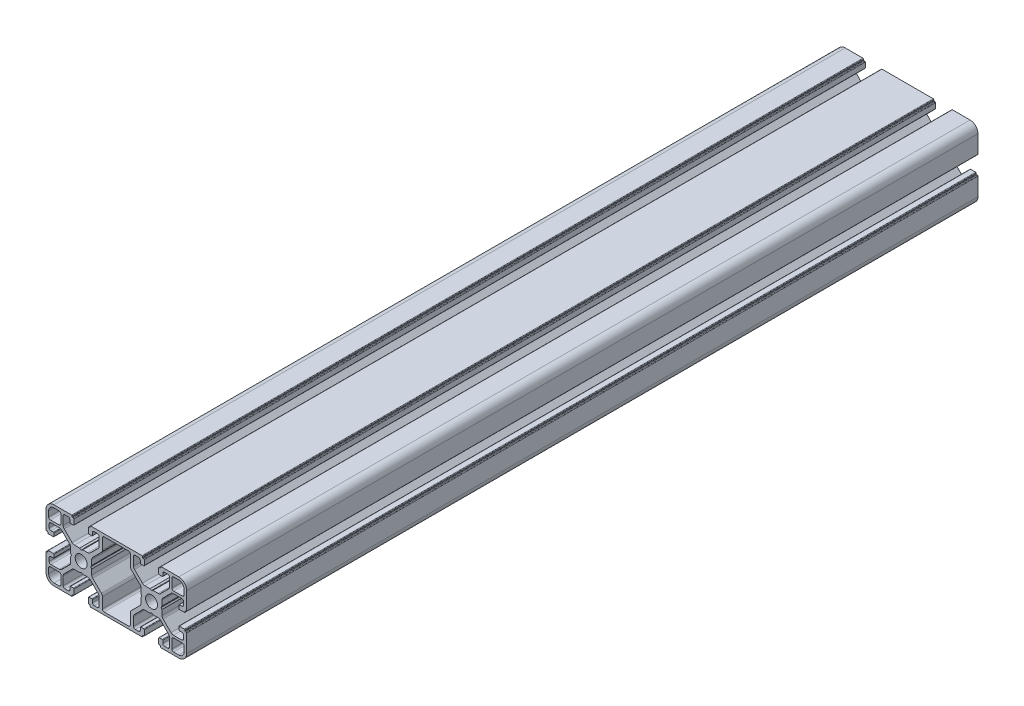
from build123d import *

# Parameters (mm, degrees)
MODEL_R             = 3.4
BOSS_EXTRUDE1_DEPTH = 450


with BuildPart() as part:
    # Model → Boss-Extrude1 (new body)
    with BuildSketch(Plane.XY):
        with BuildLine():
            Line((15.6, -19), (15.1, -19))
            ThreePointArc((15.1, -19), (14.958578644, -19.058578644), (14.9, -19.2))
            Line((14.9, -19.2), (14.9, -19.7))
            ThreePointArc((14.9, -19.7), (14.812132034, -19.912132034), (14.6, -20))
            Line((14.6, -20), (-14.6, -20))
            ThreePointArc((-14.6, -20), (-14.812132034, -19.912132034), (-14.9, -19.7))
            Line((-14.9, -19.7), (-14.9, -19.2))
            ThreePointArc((-14.9, -19.2), (-14.958578644, -19.058578644), (-15.1, -19))
            Line((-15.1, -19), (-15.6, -19))
            ThreePointArc((-15.6, -19), (-15.798740378, -18.973110567), (-15.9, -18.8))
            Line((-15.9, -18.8), (-15.9, -15.8))
            ThreePointArc((-15.9, -15.8), (-15.812132034, -15.587867966), (-15.6, -15.5))
            Line((-15.6, -15.5), (-13.9, -15.5))
            ThreePointArc((-13.9, -15.5), (-13.687867966, -15.587867966), (-13.6, -15.8))
            Line((-13.6, -15.8), (-13.6, -17.2))
            ThreePointArc((-13.6, -17.2), (-13.307106781, -17.907106781), (-12.6, -18.2))
            Line((-12.6, -18.2), (-10.75, -18.2))
            ThreePointArc((-10.75, -18.2), (-10.042893219, -17.907106781), (-9.75, -17.2))
            Line((-9.75, -17.2), (-9.75, -12.492640687))
            ThreePointArc((-9.75, -12.492640687), (-9.902240935, -11.727273822), (-10.335786438, -11.078427125))
            Line((-10.335786438, -11.078427125), (-14.828427125, -6.585786438))
            ThreePointArc((-14.828427125, -6.585786438), (-15.477273822, -6.152240935), (-16.242640687, -6))
            Line((-16.242640687, -6), (-19.133974596, -6))
            Line((-19.133974596, -6), (-20, -5.5))
            Line((-20, -5.5), (-20.866025404, -6))
            Line((-20.866025404, -6), (-23.757359313, -6))
            ThreePointArc((-23.757359313, -6), (-24.522726178, -6.152240935), (-25.171572875, -6.585786438))
            Line((-25.171572875, -6.585786438), (-29.664213562, -11.078427125))
            ThreePointArc((-29.664213562, -11.078427125), (-30.097759065, -11.727273822), (-30.25, -12.492640687))
            Line((-30.25, -12.492640687), (-30.25, -17.2))
            ThreePointArc((-30.25, -17.2), (-29.957106781, -17.907106781), (-29.25, -18.2))
            Line((-29.25, -18.2), (-27.4, -18.2))
            ThreePointArc((-27.4, -18.2), (-26.692893219, -17.907106781), (-26.4, -17.2))
            Line((-26.4, -17.2), (-26.4, -15.8))
            ThreePointArc((-26.4, -15.8), (-26.312132034, -15.587867966), (-26.1, -15.5))
            Line((-26.1, -15.5), (-24.4, -15.5))
            ThreePointArc((-24.4, -15.5), (-24.187867966, -15.587867966), (-24.1, -15.8))
            Line((-24.1, -15.8), (-24.1, -18.8))
            ThreePointArc((-24.1, -18.8), (-24.201259622, -18.973110567), (-24.4, -19))
            Line((-24.4, -19), (-24.9, -19))
            ThreePointArc((-24.9, -19), (-25.041421356, -19.058578644), (-25.1, -19.2))
            Line((-25.1, -19.2), (-25.1, -19.7))
            ThreePointArc((-25.1, -19.7), (-25.187867966, -19.912132034), (-25.4, -20))
            Line((-25.4, -20), (-35.5, -20))
            ThreePointArc((-35.5, -20), (-38.681980515, -18.681980515), (-40, -15.5))
            Line((-40, -15.5), (-40, -5.4))
            ThreePointArc((-40, -5.4), (-39.912132034, -5.187867966), (-39.7, -5.1))
            Line((-39.7, -5.1), (-39.2, -5.1))
            ThreePointArc((-39.2, -5.1), (-39.058578644, -5.041421356), (-39, -4.9))
            Line((-39, -4.9), (-39, -4.4))
            ThreePointArc((-39, -4.4), (-38.912132034, -4.187867966), (-38.7, -4.1))
            Line((-38.7, -4.1), (-35.8, -4.1))
            ThreePointArc((-35.8, -4.1), (-35.587867966, -4.187867966), (-35.5, -4.4))
            Line((-35.5, -4.4), (-35.5, -6.1))
            ThreePointArc((-35.5, -6.1), (-35.587867966, -6.312132034), (-35.8, -6.4))
            Line((-35.8, -6.4), (-37.2, -6.4))
            ThreePointArc((-37.2, -6.4), (-37.907106781, -6.692893219), (-38.2, -7.4))
            Line((-38.2, -7.4), (-38.2, -9.25))
            ThreePointArc((-38.2, -9.25), (-37.907106781, -9.957106781), (-37.2, -10.25))
            Line((-37.2, -10.25), (-32.492640687, -10.25))
            ThreePointArc((-32.492640687, -10.25), (-31.727273822, -10.097759065), (-31.078427125, -9.664213562))
            Line((-31.078427125, -9.664213562), (-26.585786438, -5.171572875))
            ThreePointArc((-26.585786438, -5.171572875), (-26.152240935, -4.522726178), (-26, -3.757359313))
            Line((-26, -3.757359313), (-26, -0.866025404))
            Line((-26, -0.866025404), (-25.5, 0))
            Line((-25.5, 0), (-26, 0.866025404))
            Line((-26, 0.866025404), (-26, 3.757359313))
            ThreePointArc((-26, 3.757359313), (-26.152240935, 4.522726178), (-26.585786438, 5.171572875))
            Line((-26.585786438, 5.171572875), (-31.078427125, 9.664213562))
            ThreePointArc((-31.078427125, 9.664213562), (-31.727273822, 10.097759065), (-32.492640687, 10.25))
            Line((-32.492640687, 10.25), (-37.2, 10.25))
            ThreePointArc((-37.2, 10.25), (-37.907106781, 9.957106781), (-38.2, 9.25))
            Line((-38.2, 9.25), (-38.2, 7.4))
            ThreePointArc((-38.2, 7.4), (-37.907106781, 6.692893219), (-37.2, 6.4))
            Line((-37.2, 6.4), (-35.8, 6.4))
            ThreePointArc((-35.8, 6.4), (-35.587867966, 6.312132034), (-35.5, 6.1))
            Line((-35.5, 6.1), (-35.5, 4.4))
            ThreePointArc((-35.5, 4.4), (-35.587867966, 4.187867966), (-35.8, 4.1))
            Line((-35.8, 4.1), (-38.7, 4.1))
            ThreePointArc((-38.7, 4.1), (-38.912132034, 4.187867966), (-39, 4.4))
            Line((-39, 4.4), (-39, 4.9))
            ThreePointArc((-39, 4.9), (-39.058578644, 5.041421356), (-39.2, 5.1))
            Line((-39.2, 5.1), (-39.7, 5.1))
            ThreePointArc((-39.7, 5.1), (-39.912132034, 5.187867966), (-40, 5.4))
            Line((-40, 5.4), (-40, 15.5))
            ThreePointArc((-40, 15.5), (-38.681980515, 18.681980515), (-35.5, 20))
            Line((-35.5, 20), (-25.4, 20))
            ThreePointArc((-25.4, 20), (-25.187867966, 19.912132034), (-25.1, 19.7))
            Line((-25.1, 19.7), (-25.1, 19.2))
            ThreePointArc((-25.1, 19.2), (-25.041421356, 19.058578644), (-24.9, 19))
            Line((-24.9, 19), (-24.4, 19))
            ThreePointArc((-24.4, 19), (-24.187867966, 18.912132034), (-24.1, 18.7))
            Line((-24.1, 18.7), (-24.1, 15.8))
            ThreePointArc((-24.1, 15.8), (-24.187867966, 15.587867966), (-24.4, 15.5))
            Line((-24.4, 15.5), (-26.1, 15.5))
            ThreePointArc((-26.1, 15.5), (-26.312132034, 15.587867966), (-26.4, 15.8))
            Line((-26.4, 15.8), (-26.4, 17.2))
            ThreePointArc((-26.4, 17.2), (-26.692893219, 17.907106781), (-27.4, 18.2))
            Line((-27.4, 18.2), (-29.25, 18.2))
            ThreePointArc((-29.25, 18.2), (-29.957106781, 17.907106781), (-30.25, 17.2))
            Line((-30.25, 17.2), (-30.25, 12.492640687))
            ThreePointArc((-30.25, 12.492640687), (-30.097759065, 11.727273822), (-29.664213562, 11.078427125))
            Line((-29.664213562, 11.078427125), (-25.171572875, 6.585786438))
            ThreePointArc((-25.171572875, 6.585786438), (-24.522726178, 6.152240935), (-23.757359313, 6))
            Line((-23.757359313, 6), (-20.866025404, 6))
            Line((-20.866025404, 6), (-20, 5.5))
            Line((-20, 5.5), (-19.133974596, 6))
            Line((-19.133974596, 6), (-16.242640687, 6))
            ThreePointArc((-16.242640687, 6), (-15.477273822, 6.152240935), (-14.828427125, 6.585786438))
            Line((-14.828427125, 6.585786438), (-10.335786438, 11.078427125))
            ThreePointArc((-10.335786438, 11.078427125), (-9.902240935, 11.727273822), (-9.75, 12.492640687))
            Line((-9.75, 12.492640687), (-9.75, 17.2))
            ThreePointArc((-9.75, 17.2), (-10.042893219, 17.907106781), (-10.75, 18.2))
            Line((-10.75, 18.2), (-12.6, 18.2))
            ThreePointArc((-12.6, 18.2), (-13.307106781, 17.907106781), (-13.6, 17.2))
            Line((-13.6, 17.2), (-13.6, 15.8))
            ThreePointArc((-13.6, 15.8), (-13.687867966, 15.587867966), (-13.9, 15.5))
            Line((-13.9, 15.5), (-15.6, 15.5))
            ThreePointArc((-15.6, 15.5), (-15.812132034, 15.587867966), (-15.9, 15.8))
            Line((-15.9, 15.8), (-15.9, 18.7))
            ThreePointArc((-15.9, 18.7), (-15.812132034, 18.912132034), (-15.6, 19))
            Line((-15.6, 19), (-15.1, 19))
            ThreePointArc((-15.1, 19), (-14.958578644, 19.058578644), (-14.9, 19.2))
            Line((-14.9, 19.2), (-14.9, 19.7))
            ThreePointArc((-14.9, 19.7), (-14.812132034, 19.912132034), (-14.6, 20))
            Line((-14.6, 20), (14.6, 20))
            ThreePointArc((14.6, 20), (14.812132034, 19.912132034), (14.9, 19.7))
            Line((14.9, 19.7), (14.9, 19.2))
            ThreePointArc((14.9, 19.2), (14.958578644, 19.058578644), (15.1, 19))
            Line((15.1, 19), (15.6, 19))
            ThreePointArc((15.6, 19), (15.812132034, 18.912132034), (15.9, 18.7))
            Line((15.9, 18.7), (15.9, 15.8))
            ThreePointArc((15.9, 15.8), (15.812132034, 15.587867966), (15.6, 15.5))
            Line((15.6, 15.5), (13.9, 15.5))
            ThreePointArc((13.9, 15.5), (13.687867966, 15.587867966), (13.6, 15.8))
            Line((13.6, 15.8), (13.6, 17.2))
            ThreePointArc((13.6, 17.2), (13.307106781, 17.907106781), (12.6, 18.2))
            Line((12.6, 18.2), (10.75, 18.2))
            ThreePointArc((10.75, 18.2), (10.042893219, 17.907106781), (9.75, 17.2))
            Line((9.75, 17.2), (9.75, 12.492640687))
            ThreePointArc((9.75, 12.492640687), (9.902240935, 11.727273822), (10.335786438, 11.078427125))
            Line((10.335786438, 11.078427125), (14.828427125, 6.585786438))
            ThreePointArc((14.828427125, 6.585786438), (15.477273822, 6.152240935), (16.242640687, 6))
            Line((16.242640687, 6), (19.133974596, 6))
            Line((19.133974596, 6), (20, 5.5))
            Line((20, 5.5), (20.866025404, 6))
            Line((20.866025404, 6), (23.757359313, 6))
            ThreePointArc((23.757359313, 6), (24.522726178, 6.152240935), (25.171572875, 6.585786438))
            Line((25.171572875, 6.585786438), (29.664213562, 11.078427125))
            ThreePointArc((29.664213562, 11.078427125), (30.097759065, 11.727273822), (30.25, 12.492640687))
            Line((30.25, 12.492640687), (30.25, 17.2))
            ThreePointArc((30.25, 17.2), (29.957106781, 17.907106781), (29.25, 18.2))
            Line((29.25, 18.2), (27.4, 18.2))
            ThreePointArc((27.4, 18.2), (26.692893219, 17.907106781), (26.4, 17.2))
            Line((26.4, 17.2), (26.4, 15.8))
            ThreePointArc((26.4, 15.8), (26.312132034, 15.587867966), (26.1, 15.5))
            Line((26.1, 15.5), (24.4, 15.5))
            ThreePointArc((24.4, 15.5), (24.187867966, 15.587867966), (24.1, 15.8))
            Line((24.1, 15.8), (24.1, 18.7))
            ThreePointArc((24.1, 18.7), (24.187867966, 18.912132034), (24.4, 19))
            Line((24.4, 19), (24.9, 19))
            ThreePointArc((24.9, 19), (25.041421356, 19.058578644), (25.1, 19.2))
            Line((25.1, 19.2), (25.1, 19.7))
            ThreePointArc((25.1, 19.7), (25.187867966, 19.912132034), (25.4, 20))
            Line((25.4, 20), (35.5, 20))
            ThreePointArc((35.5, 20), (38.681980515, 18.681980515), (40, 15.5))
            Line((40, 15.5), (40, 5.4))
            ThreePointArc((40, 5.4), (39.912132034, 5.187867966), (39.7, 5.1))
            Line((39.7, 5.1), (39.2, 5.1))
            ThreePointArc((39.2, 5.1), (39.058578644, 5.041421356), (39, 4.9))
            Line((39, 4.9), (39, 4.4))
            ThreePointArc((39, 4.4), (38.912132034, 4.187867966), (38.7, 4.1))
            Line((38.7, 4.1), (35.8, 4.1))
            ThreePointArc((35.8, 4.1), (35.587867966, 4.187867966), (35.5, 4.4))
            Line((35.5, 4.4), (35.5, 6.1))
            ThreePointArc((35.5, 6.1), (35.587867966, 6.312132034), (35.8, 6.4))
            Line((35.8, 6.4), (37.2, 6.4))
            ThreePointArc((37.2, 6.4), (37.907106781, 6.692893219), (38.2, 7.4))
            Line((38.2, 7.4), (38.2, 9.25))
            ThreePointArc((38.2, 9.25), (37.907106781, 9.957106781), (37.2, 10.25))
            Line((37.2, 10.25), (32.492640687, 10.25))
            ThreePointArc((32.492640687, 10.25), (31.727273822, 10.097759065), (31.078427125, 9.664213562))
            Line((31.078427125, 9.664213562), (26.585786438, 5.171572875))
            ThreePointArc((26.585786438, 5.171572875), (26.152240935, 4.522726178), (26, 3.757359313))
            Line((26, 3.757359313), (26, 0.866025404))
            Line((26, 0.866025404), (25.5, 0))
            Line((25.5, 0), (26, -0.866025404))
            Line((26, -0.866025404), (26, -3.757359313))
            ThreePointArc((26, -3.757359313), (26.152240935, -4.522726178), (26.585786438, -5.171572875))
            Line((26.585786438, -5.171572875), (31.078427125, -9.664213562))
            ThreePointArc((31.078427125, -9.664213562), (31.727273822, -10.097759065), (32.492640687, -10.25))
            Line((32.492640687, -10.25), (37.2, -10.25))
            ThreePointArc((37.2, -10.25), (37.907106781, -9.957106781), (38.2, -9.25))
            Line((38.2, -9.25), (38.2, -7.4))
            ThreePointArc((38.2, -7.4), (37.907106781, -6.692893219), (37.2, -6.4))
            Line((37.2, -6.4), (35.8, -6.4))
            ThreePointArc((35.8, -6.4), (35.587867966, -6.312132034), (35.5, -6.1))
            Line((35.5, -6.1), (35.5, -4.4))
            ThreePointArc((35.5, -4.4), (35.587867966, -4.187867966), (35.8, -4.1))
            Line((35.8, -4.1), (38.7, -4.1))
            ThreePointArc((38.7, -4.1), (38.912132034, -4.187867966), (39, -4.4))
            Line((39, -4.4), (39, -4.9))
            ThreePointArc((39, -4.9), (39.058578644, -5.041421356), (39.2, -5.1))
            Line((39.2, -5.1), (39.7, -5.1))
            ThreePointArc((39.7, -5.1), (39.912132034, -5.187867966), (40, -5.4))
            Line((40, -5.4), (40, -15.5))
            ThreePointArc((40, -15.5), (38.681980515, -18.681980515), (35.5, -20))
            Line((35.5, -20), (25.4, -20))
            ThreePointArc((25.4, -20), (25.187867966, -19.912132034), (25.1, -19.7))
            Line((25.1, -19.7), (25.1, -19.2))
            ThreePointArc((25.1, -19.2), (25.041421356, -19.058578644), (24.9, -19))
            Line((24.9, -19), (24.4, -19))
            ThreePointArc((24.4, -19), (24.201259622, -18.973110567), (24.1, -18.8))
            Line((24.1, -18.8), (24.1, -15.8))
            ThreePointArc((24.1, -15.8), (24.187867966, -15.587867966), (24.4, -15.5))
            Line((24.4, -15.5), (26.1, -15.5))
            ThreePointArc((26.1, -15.5), (26.312132034, -15.587867966), (26.4, -15.8))
            Line((26.4, -15.8), (26.4, -17.2))
            ThreePointArc((26.4, -17.2), (26.692893219, -17.907106781), (27.4, -18.2))
            Line((27.4, -18.2), (29.25, -18.2))
            ThreePointArc((29.25, -18.2), (29.957106781, -17.907106781), (30.25, -17.2))
            Line((30.25, -17.2), (30.25, -12.492640687))
            ThreePointArc((30.25, -12.492640687), (30.097759065, -11.727273822), (29.664213562, -11.078427125))
            Line((29.664213562, -11.078427125), (25.171572875, -6.585786438))
            ThreePointArc((25.171572875, -6.585786438), (24.522726178, -6.152240935), (23.757359313, -6))
            Line((23.757359313, -6), (20.866025404, -6))
            Line((20.866025404, -6), (20, -5.5))
            Line((20, -5.5), (19.133974596, -6))
            Line((19.133974596, -6), (16.242640687, -6))
            ThreePointArc((16.242640687, -6), (15.477273822, -6.152240935), (14.828427125, -6.585786438))
            Line((14.828427125, -6.585786438), (10.335786438, -11.078427125))
            ThreePointArc((10.335786438, -11.078427125), (9.902240935, -11.727273822), (9.75, -12.492640687))
            Line((9.75, -12.492640687), (9.75, -17.2))
            ThreePointArc((9.75, -17.2), (10.042893219, -17.907106781), (10.75, -18.2))
            Line((10.75, -18.2), (12.6, -18.2))
            ThreePointArc((12.6, -18.2), (13.307106781, -17.907106781), (13.6, -17.2))
            Line((13.6, -17.2), (13.6, -15.8))
            ThreePointArc((13.6, -15.8), (13.687867966, -15.587867966), (13.9, -15.5))
            Line((13.9, -15.5), (15.6, -15.5))
            ThreePointArc((15.6, -15.5), (15.812132034, -15.587867966), (15.9, -15.8))
            Line((15.9, -15.8), (15.9, -18.8))
            ThreePointArc((15.9, -18.8), (15.798740378, -18.973110567), (15.6, -19))
        make_face()
        with Locations((-20, 0)):
            Circle(MODEL_R, mode=Mode.SUBTRACT)
        with Locations((20, 0)):
            Circle(MODEL_R, mode=Mode.SUBTRACT)
        with BuildLine():
            Line((8.535786438, 10.05), (13.414213562, 5.171572875))
            ThreePointArc((13.414213562, 5.171572875), (13.847759065, 4.522726178), (14, 3.757359313))
            Line((14, 3.757359313), (14, 0.866025404))
            Line((14, 0.866025404), (14.5, 0))
            Line((14.5, 0), (14, -0.866025404))
            Line((14, -0.866025404), (14, -3.757359313))
            ThreePointArc((14, -3.757359313), (13.847759065, -4.522726178), (13.414213562, -5.171572875))
            Line((13.414213562, -5.171572875), (8.535786438, -10.05))
            ThreePointArc((8.535786438, -10.05), (8.102240935, -10.698846698), (7.95, -11.464213562))
            Line((7.95, -11.464213562), (7.95, -17.5))
            ThreePointArc((7.95, -17.5), (7.657106781, -18.207106781), (6.95, -18.5))
            Line((6.95, -18.5), (-6.95, -18.5))
            ThreePointArc((-6.95, -18.5), (-7.657106781, -18.207106781), (-7.95, -17.5))
            Line((-7.95, -17.5), (-7.95, -11.464213562))
            ThreePointArc((-7.95, -11.464213562), (-8.102240935, -10.698846698), (-8.535786438, -10.05))
            Line((-8.535786438, -10.05), (-13.414213562, -5.171572875))
            ThreePointArc((-13.414213562, -5.171572875), (-13.847759065, -4.522726178), (-14, -3.757359313))
            Line((-14, -3.757359313), (-14, -0.866025404))
            Line((-14, -0.866025404), (-14.5, 0))
            Line((-14.5, 0), (-14, 0.866025404))
            Line((-14, 0.866025404), (-14, 3.757359313))
            ThreePointArc((-14, 3.757359313), (-13.847759065, 4.522726178), (-13.414213562, 5.171572875))
            Line((-13.414213562, 5.171572875), (-8.535786438, 10.05))
            ThreePointArc((-8.535786438, 10.05), (-8.102240935, 10.698846698), (-7.95, 11.464213562))
            Line((-7.95, 11.464213562), (-7.95, 17.5))
            ThreePointArc((-7.95, 17.5), (-7.657106781, 18.207106781), (-6.95, 18.5))
            Line((-6.95, 18.5), (6.95, 18.5))
            ThreePointArc((6.95, 18.5), (7.657106781, 18.207106781), (7.95, 17.5))
            Line((7.95, 17.5), (7.95, 11.464213562))
            ThreePointArc((7.95, 11.464213562), (8.102240935, 10.698846698), (8.535786438, 10.05))
        make_face(mode=Mode.SUBTRACT)
        with BuildLine():
            Line((31.55, -17.5), (31.55, -12.55))
            ThreePointArc((31.55, -12.55), (31.842893219, -11.842893219), (32.55, -11.55))
            Line((32.55, -11.55), (37.5, -11.55))
            ThreePointArc((37.5, -11.55), (38.207106781, -11.842893219), (38.5, -12.55))
            Line((38.5, -12.55), (38.5, -15.5))
            ThreePointArc((38.5, -15.5), (37.621320344, -17.621320344), (35.5, -18.5))
            Line((35.5, -18.5), (32.55, -18.5))
            ThreePointArc((32.55, -18.5), (31.842893219, -18.207106781), (31.55, -17.5))
        make_face(mode=Mode.SUBTRACT)
        with BuildLine():
            Line((32.55, 18.5), (35.5, 18.5))
            ThreePointArc((35.5, 18.5), (37.621320344, 17.621320344), (38.5, 15.5))
            Line((38.5, 15.5), (38.5, 12.55))
            ThreePointArc((38.5, 12.55), (38.207106781, 11.842893219), (37.5, 11.55))
            Line((37.5, 11.55), (32.55, 11.55))
            ThreePointArc((32.55, 11.55), (31.842893219, 11.842893219), (31.55, 12.55))
            Line((31.55, 12.55), (31.55, 17.5))
            ThreePointArc((31.55, 17.5), (31.842893219, 18.207106781), (32.55, 18.5))
        make_face(mode=Mode.SUBTRACT)
        with BuildLine():
            Line((-31.55, 17.5), (-31.55, 12.55))
            ThreePointArc((-31.55, 12.55), (-31.842893219, 11.842893219), (-32.55, 11.55))
            Line((-32.55, 11.55), (-37.5, 11.55))
            ThreePointArc((-37.5, 11.55), (-38.207106781, 11.842893219), (-38.5, 12.55))
            Line((-38.5, 12.55), (-38.5, 15.5))
            ThreePointArc((-38.5, 15.5), (-37.621320344, 17.621320344), (-35.5, 18.5))
            Line((-35.5, 18.5), (-32.55, 18.5))
            ThreePointArc((-32.55, 18.5), (-31.842893219, 18.207106781), (-31.55, 17.5))
        make_face(mode=Mode.SUBTRACT)
        with BuildLine():
            Line((-32.55, -18.5), (-35.5, -18.5))
            ThreePointArc((-35.5, -18.5), (-37.621320344, -17.621320344), (-38.5, -15.5))
            Line((-38.5, -15.5), (-38.5, -12.55))
            ThreePointArc((-38.5, -12.55), (-38.207106781, -11.842893219), (-37.5, -11.55))
            Line((-37.5, -11.55), (-32.55, -11.55))
            ThreePointArc((-32.55, -11.55), (-31.842893219, -11.842893219), (-31.55, -12.55))
            Line((-31.55, -12.55), (-31.55, -17.5))
            ThreePointArc((-31.55, -17.5), (-31.842893219, -18.207106781), (-32.55, -18.5))
        make_face(mode=Mode.SUBTRACT)
    extrude(amount=BOSS_EXTRUDE1_DEPTH)


solid = part.part
